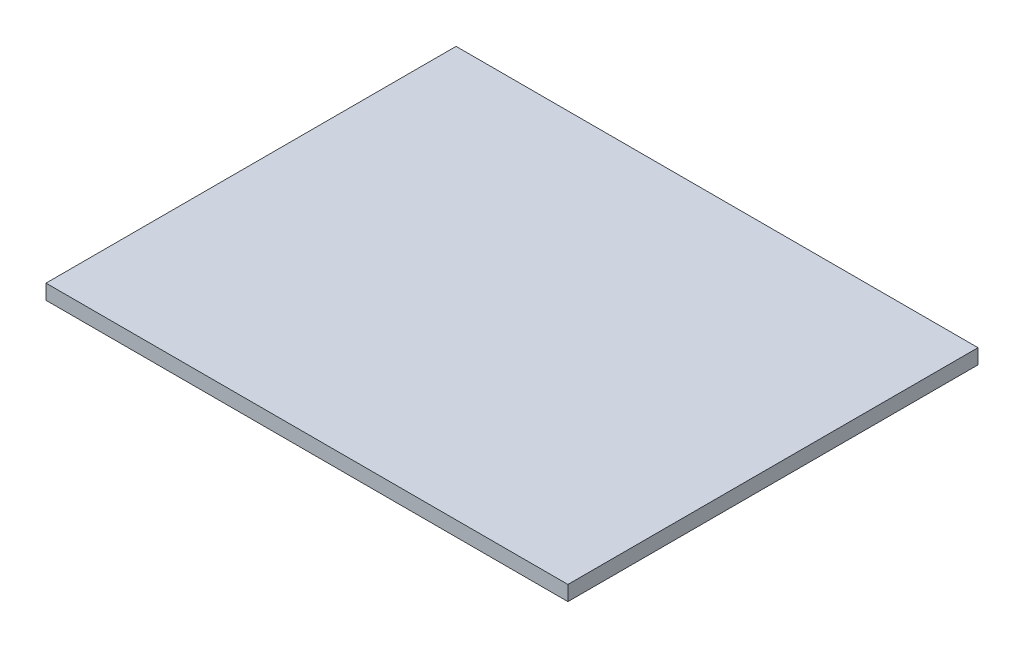
from build123d import *

# Parameters (mm, degrees)
SKETCH1_W           = 70
SKETCH1_H           = 55
BOSS_EXTRUDE1_DEPTH = 2


with BuildPart() as part:
    # Sketch1 → Boss-Extrude1 (new body)
    with BuildSketch(Plane(origin=(0, 0, 0), x_dir=(1, 0, 0), z_dir=(0, 1, 0))):
        Rectangle(SKETCH1_W, SKETCH1_H)
    extrude(amount=BOSS_EXTRUDE1_DEPTH)


solid = part.part
